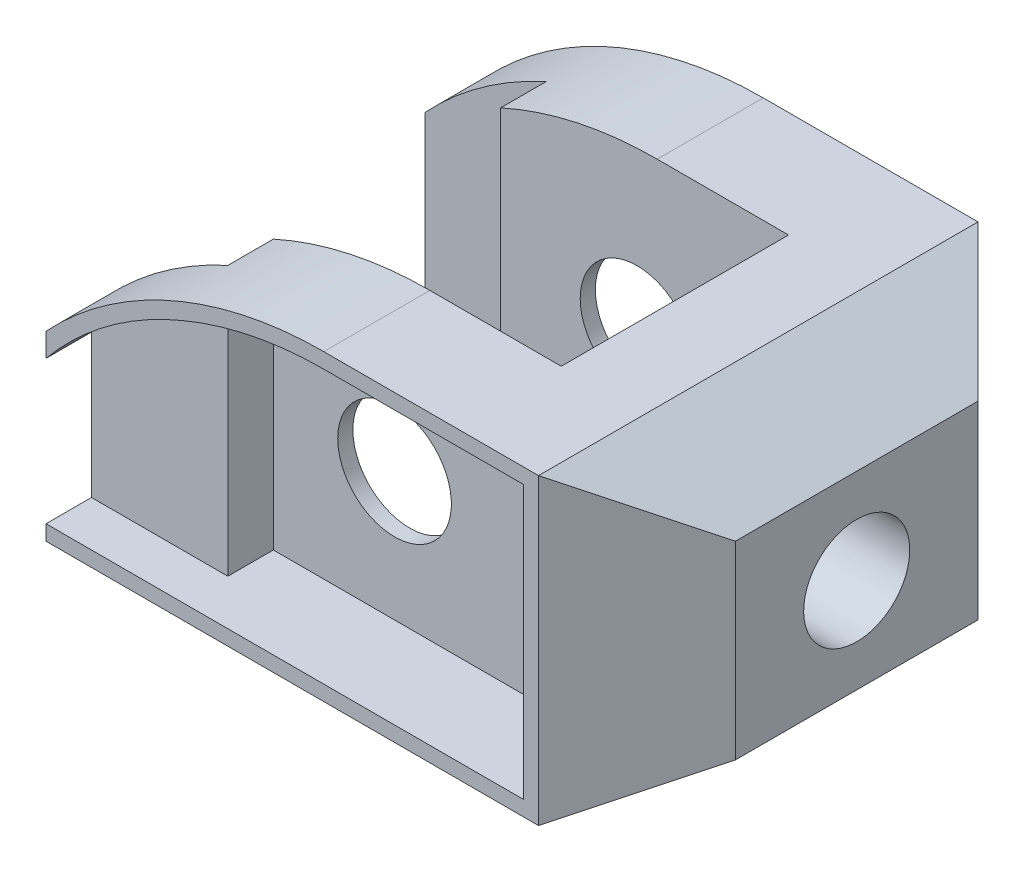
from build123d import *

# Parameters (mm, degrees)
SKETCH1_R           = 7.5
BOSS_EXTRUDE1_DEPTH = 58
SKETCH2_W           = 38
SKETCH2_H           = 30
CUT_EXTRUDE1_DEPTH  = 58
SKETCH3_W           = 16
SKETCH3_H           = 6
CUT_EXTRUDE2_DEPTH  = 58
CUT_EXTRUDE3_DEPTH  = 58
SKETCH5_R           = 7
CUT_EXTRUDE4_DEPTH  = 58
CUT_EXTRUDE5_DEPTH  = 12
CUT_EXTRUDE6_DEPTH  = 6
CUT_EXTRUDE7_DEPTH  = 12
CUT_EXTRUDE8_DEPTH  = 6


with BuildPart() as part:
    # Sketch1 → Boss-Extrude1 (new body)
    with BuildSketch(Plane.XY):
        with BuildLine():
            Line((-34, 5), (-34, -19))
            Line((-34, -19), (31, -19))
            Line((31, -19), (43.990381057, -11.5))
            Line((43.990381057, -11.5), (43.990381057, 13.5))
            Line((43.990381057, 13.5), (31, 21))
            Line((31, 21), (2.66060556, 21))
            ThreePointArc((2.66060556, 21), (-17.33939444, 16.82575695), (-34, 5))
        make_face()
        Circle(SKETCH1_R, mode=Mode.SUBTRACT)
    extrude(amount=BOSS_EXTRUDE1_DEPTH)

    # Sketch2 → Cut-Extrude1 (cut)
    with BuildSketch(Plane(origin=(0, 21, 0), x_dir=(1, 0, 0), z_dir=(0, 1, 0))):
        with Locations((1, -29)):
            Rectangle(SKETCH2_W, SKETCH2_H)
    extrude(amount=-CUT_EXTRUDE1_DEPTH, mode=Mode.SUBTRACT)

    # Sketch3 → Cut-Extrude2 (cut)
    with BuildSketch(Plane(origin=(0, 21, 0), x_dir=(1, 0, 0), z_dir=(0, 1, 0))):
        with Locations((-26, -11)):
            Rectangle(SKETCH3_W, SKETCH3_H)
        with Locations((-26, -47)):
            Rectangle(SKETCH3_W, SKETCH3_H)
    extrude(amount=-CUT_EXTRUDE2_DEPTH, mode=Mode.SUBTRACT)


with BuildPart() as body_2:
    # of the pieces the cut leaves, the one that is kept (cut_extrude2_keep)
    add(part.part.solids().sort_by_distance((-34, 5, 0))[0])

    # Sketch4 → Cut-Extrude3 (cut)
    with BuildSketch(Plane(origin=(0, 21, 0), x_dir=(1, 0, 0), z_dir=(0, 1, 0))):
        Polygon((31, 0), (43.990381057, 0), (43.990381057, -12.990381057), align=None)
        Polygon((43.990381057, -58), (43.990381057, -45.009618943), (31, -58), align=None)
    extrude(amount=-CUT_EXTRUDE3_DEPTH, mode=Mode.SUBTRACT)

    # Sketch5 → Cut-Extrude4 (cut)
    with BuildSketch(Plane(origin=(43.990381057, 0, 0), x_dir=(0, 0, -1), z_dir=(1, 0, 0))):
        with Locations((-29, 1)):
            Circle(SKETCH5_R)
    extrude(amount=-CUT_EXTRUDE4_DEPTH, mode=Mode.SUBTRACT)

    # Sketch8 → Cut-Extrude5 (cut)
    with BuildSketch(Plane.XY.offset(58)):
        with BuildLine():
            Line((-16, 15.224221872), (-16, -17))
            Line((-16, -17), (29, -17))
            Line((29, -17), (29, 19))
            Line((29, 19), (2.66060556, 19))
            ThreePointArc((2.66060556, 19), (-6.858778616, 18.046586751), (-16, 15.224221872))
        make_face()
    extrude(amount=-CUT_EXTRUDE5_DEPTH, mode=Mode.SUBTRACT)

    # Sketch10 → Cut-Extrude6 (cut)
    with BuildSketch(Plane.XY.offset(58)):
        with BuildLine():
            Line((-16, -17), (-16, 15.224221872))
            ThreePointArc((-16, 15.224221872), (-25.82281671, 9.672366481), (-34, 1.897760392))
            Line((-34, 1.897760392), (-34, -17))
            Line((-34, -17), (-16, -17))
        make_face()
    extrude(amount=-CUT_EXTRUDE6_DEPTH, mode=Mode.SUBTRACT)

    # Sketch11 → Cut-Extrude7 (cut)
    with BuildSketch(Plane(origin=(0, 0, 0), x_dir=(-1, 0, 0), z_dir=(0, 0, -1))):
        with BuildLine():
            Line((16, 15.224221872), (16, -17))
            Line((16, -17), (-29, -17))
            Line((-29, -17), (-29, 19))
            Line((-29, 19), (-2.66060556, 19))
            ThreePointArc((-2.66060556, 19), (6.858778616, 18.046586751), (16, 15.224221872))
        make_face()
    extrude(amount=-CUT_EXTRUDE7_DEPTH, mode=Mode.SUBTRACT)

    # Sketch12 → Cut-Extrude8 (cut)
    with BuildSketch(Plane(origin=(0, 0, 0), x_dir=(-1, 0, 0), z_dir=(0, 0, -1))):
        with BuildLine():
            Line((16, 15.224221872), (16, -17))
            Line((16, -17), (34, -17))
            Line((34, -17), (34, 0.945438982))
            ThreePointArc((34, 0.945438982), (25.900918774, 9.220539125), (16, 15.224221872))
        make_face()
    extrude(amount=-CUT_EXTRUDE8_DEPTH, mode=Mode.SUBTRACT)


solid = body_2.part
